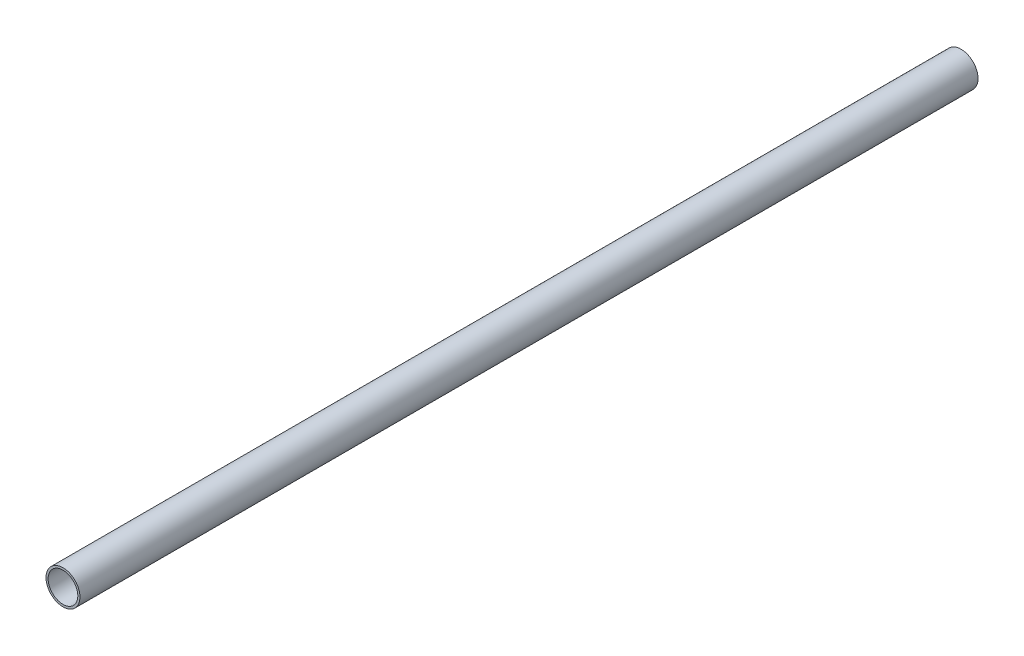
from build123d import *

# Parameters (mm, degrees)
CROQUIS1_R              = 7.9375
CROQUIS1_R_2            = 6.9375
SALIENTE_EXTRUIR1_DEPTH = 210


with BuildPart() as part:
    # Croquis1 → Saliente-Extruir1 (new, symmetric)
    with BuildSketch(Plane.XY):
        with Locations(Location((0, 0, 0), (0, 0, 180))):
            Circle(CROQUIS1_R)
        with Locations(Location((0, 0, 0), (0, 0, 180))):
            Circle(CROQUIS1_R_2, mode=Mode.SUBTRACT)
    extrude(amount=SALIENTE_EXTRUIR1_DEPTH, both=True)


solid = part.part
